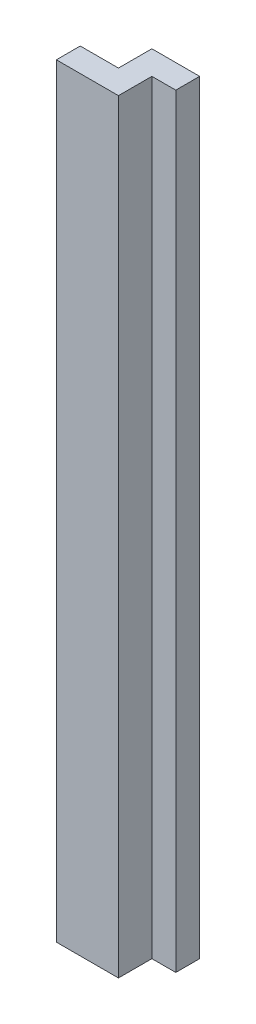
from build123d import *

# Parameters (mm, degrees)
BOSS_EXTRUDE1_DEPTH = 160
SKETCH2_W           = 5
SKETCH2_H           = 160
BOSS_EXTRUDE2_DEPTH = 5


with BuildPart() as part:
    # Sketch1 → Boss-Extrude1 (new body)
    with BuildSketch(Plane(origin=(0, 0, 0), x_dir=(1, 0, 0), z_dir=(0, 1, 0))):
        Polygon((0, 0), (8, 0), (8, 7), (13, 7), (13, -5), (8, -5), (0, -5), align=None)
    extrude(amount=BOSS_EXTRUDE1_DEPTH)

    # Sketch2 → Boss-Extrude2 (add)
    with BuildSketch(Plane(origin=(13, 0, 0), x_dir=(0, 0, -1), z_dir=(1, 0, 0))):
        with Locations((4.5, 80)):
            Rectangle(SKETCH2_W, SKETCH2_H)
    extrude(amount=BOSS_EXTRUDE2_DEPTH)


solid = part.part
